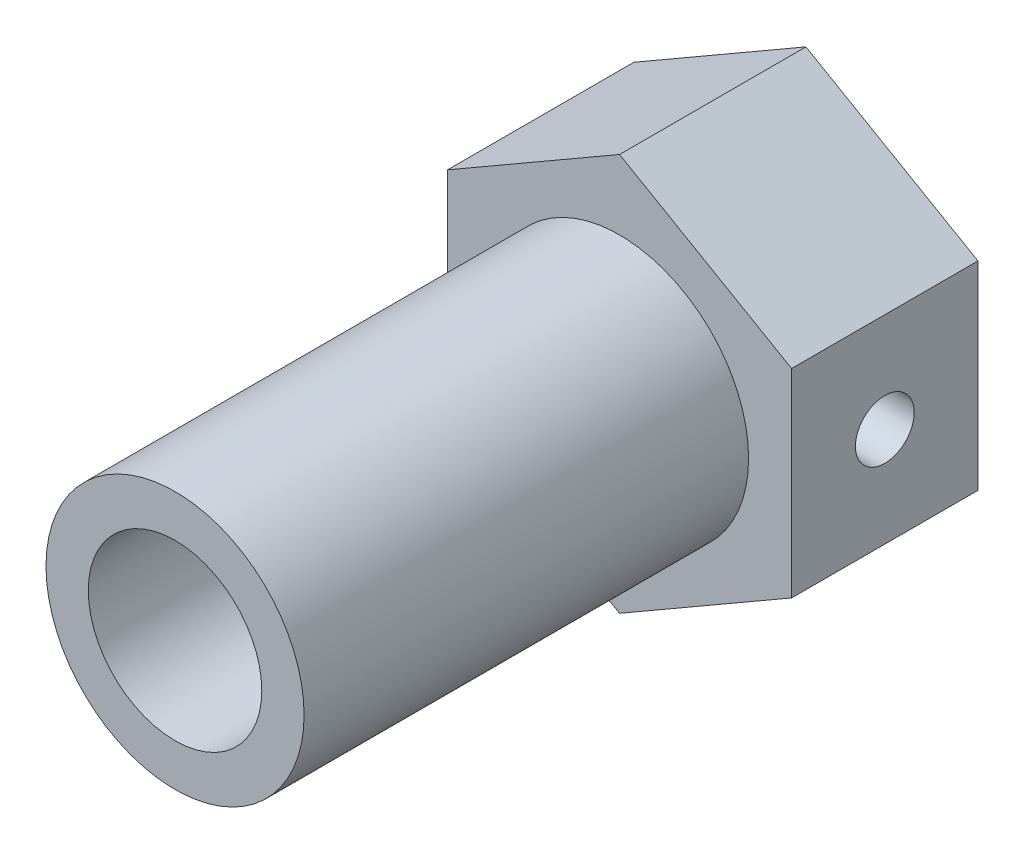
from build123d import *

# Parameters (mm, degrees)
EXTRUDE_1_DEPTH     = 13
SKETCH_2_R          = 9
EXTRUDE_2_DEPTH     = 31
SKETCH_3_R          = 8
EXTRUDE_3_DEPTH     = 1
SKETCH_4_R          = 6.05
CUT_EXTRUDE_1_DEPTH = 45
SKETCH_5_R          = 2.05
CUT_EXTRUDE_2_DEPTH = 25


with BuildPart() as part:
    # 草图1 → 凸台-拉伸1 (new body)
    with BuildSketch(Plane.XY):
        Polygon((0, 13.856406461), (-12, 6.92820323), (-12, -6.92820323), (0, -13.856406461), (12, -6.92820323), (12, 6.92820323), align=None)
    extrude(amount=EXTRUDE_1_DEPTH)

    # 草图2 → 凸台-拉伸2 (add)
    with BuildSketch(Plane.XY.offset(13)):
        Circle(SKETCH_2_R)
    extrude(amount=EXTRUDE_2_DEPTH)

    # 草图3 → 凸台-拉伸3 (add)
    with BuildSketch(Plane(origin=(0, 0, 0), x_dir=(-1, 0, 0), z_dir=(0, 0, -1))):
        Circle(SKETCH_3_R)
    extrude(amount=EXTRUDE_3_DEPTH)

    # 草图4 → 切除-拉伸1 (cut)
    with BuildSketch(Plane(origin=(0, 0, -1), x_dir=(-1, 0, 0), z_dir=(0, 0, -1))):
        Circle(SKETCH_4_R)
    extrude(amount=-CUT_EXTRUDE_1_DEPTH, mode=Mode.SUBTRACT)

    # 草图5 → 切除-拉伸2 (cut, symmetric)
    with BuildSketch(Plane(origin=(0, 0, 0), x_dir=(0, 0, -1), z_dir=(1, 0, 0))):
        with Locations((-6.5, 0)):
            Circle(SKETCH_5_R)
    extrude(amount=CUT_EXTRUDE_2_DEPTH, both=True, mode=Mode.SUBTRACT)


solid = part.part
